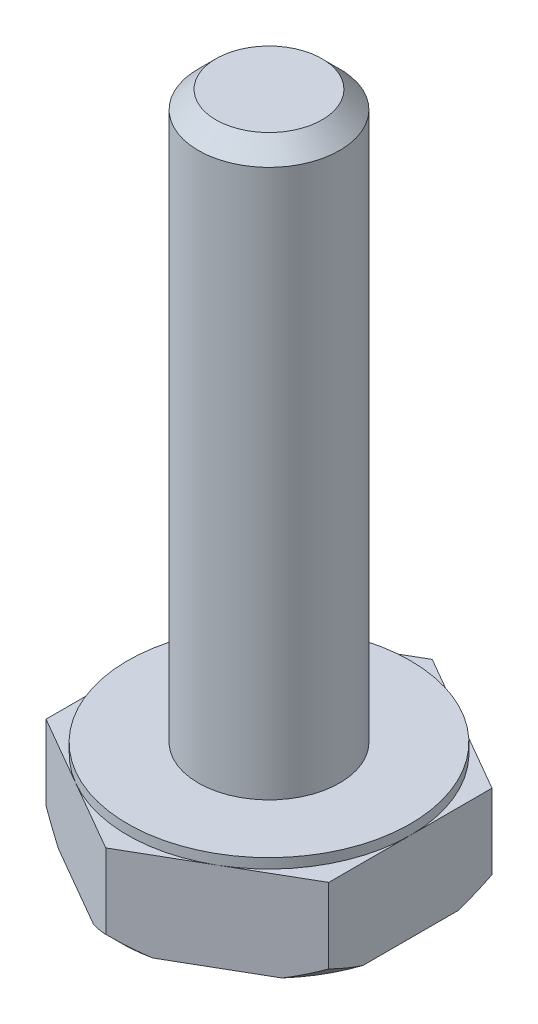
from build123d import *

# Parameters (mm, degrees)
ESQUISSE1_R    = 1
CORPS_DEPTH    = 8
ESQUISSE2_R    = 2
APPUIS_DEPTH   = 0.14
TETE_DEPTH     = 1.26
CHANFREIN_SIZE = 0.25


with BuildPart() as part:
    # Esquisse1 → CORPS (new body)
    with BuildSketch(Plane(origin=(0, 0, 0), x_dir=(1, 0, 0), z_dir=(0, 1, 0))):
        with Locations(Location((0, 0, 0), (0, 0, 270))):
            Circle(ESQUISSE1_R)
    extrude(amount=CORPS_DEPTH)

    # Esquisse2 → APPUIS (add)
    with BuildSketch(Plane(origin=(0, 0, 0), x_dir=(-1, 0, 0), z_dir=(0, -1, 0))):
        with Locations(Location((0, 0, 0), (0, 0, 90))):
            Circle(ESQUISSE2_R)
    extrude(amount=APPUIS_DEPTH)

    # Esquisse3 → TETE (add)
    with BuildSketch(Plane(origin=(0, -0.14, 0), x_dir=(-1, 0, 0), z_dir=(0, -1, 0))):
        Polygon((0, -2.309401077), (2, -1.154700538), (2, 1.154700538), (0, 2.309401077), (-2, 1.154700538), (-2, -1.154700538), align=None)
    extrude(amount=TETE_DEPTH)

    # Esquisse4 → CHANFREIN_TETE (revolve, cut)
    with BuildSketch(Plane(origin=(0, 0, 0), x_dir=(0, 0, -1), z_dir=(1, 0, 0)), mode=Mode.PRIVATE) as chanfrein_tete_sk:
        Polygon((2.309401077, -1.2), (2.109401077, -1.4), (2.309401077, -1.4), align=None)
    revolve(chanfrein_tete_sk.sketch.rotate(Axis((0, 0, 0), (0, -1, 0)), 210), axis=Axis((0, 0, 0), (0, -1, 0)), mode=Mode.SUBTRACT)

    # CHANFREIN
    chanfrein_edges = [part.edges().sort_by_distance(p)[0] for p in [
        (0, 8, -1),
    ]]
    chamfer(chanfrein_edges, length=CHANFREIN_SIZE)


solid = part.part
